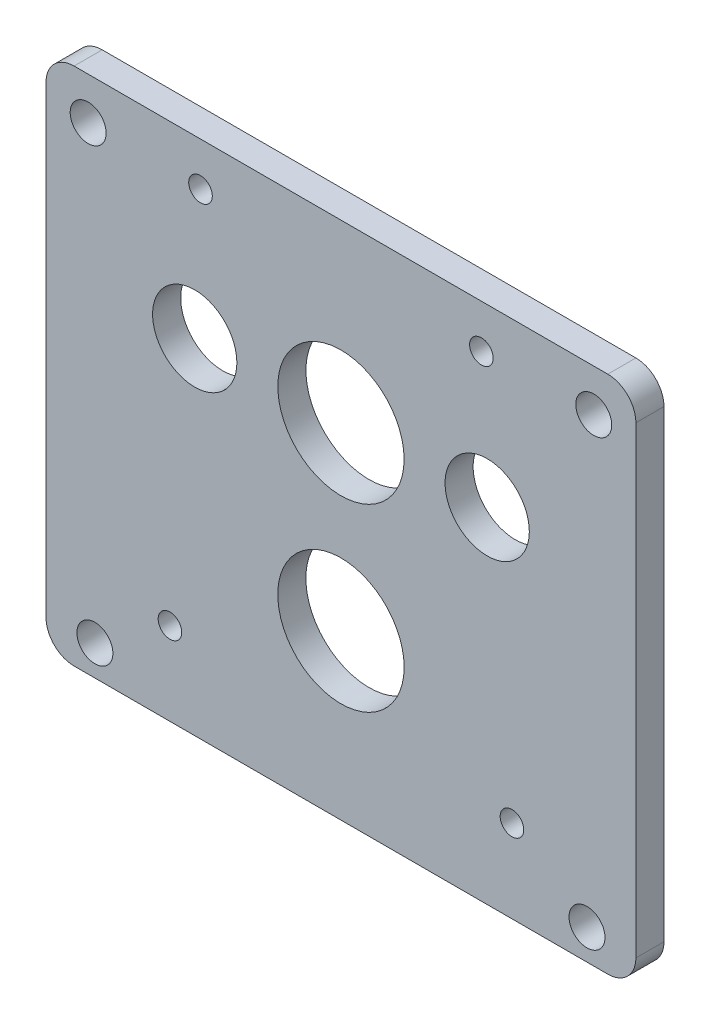
from build123d import *

# Parameters (mm, degrees)
SKETCH1_W           = 133.35
SKETCH1_H           = 117.475
SKETCH1_R           = 14.2748
SKETCH1_R_2         = 9.525
SKETCH1_R_3         = 14.2875
SKETCH1_R_4         = 4.064
SKETCH1_R_5         = 2.667
BOSS_EXTRUDE1_DEPTH = 3.175
FILLET1_R           = 6.35


with BuildPart() as part:
    # Sketch1 → Boss-Extrude1 (new, symmetric)
    with BuildSketch(Plane.XY):
        with Locations((0, 21.6789)):
            Rectangle(SKETCH1_W, SKETCH1_H)
        with Locations((0, 40.7162)):
            Circle(SKETCH1_R, mode=Mode.SUBTRACT)
        with Locations((33.0581, 40.7162)):
            Circle(SKETCH1_R_2, mode=Mode.SUBTRACT)
        with Locations((-33.0581, 40.7162)):
            Circle(SKETCH1_R_2, mode=Mode.SUBTRACT)
        Circle(SKETCH1_R_3, mode=Mode.SUBTRACT)
        with Locations((-57.15, 70.8914)):
            Circle(SKETCH1_R_4, mode=Mode.SUBTRACT)
        with Locations((-55.626, -30.2006)):
            Circle(SKETCH1_R_4, mode=Mode.SUBTRACT)
        with Locations((57.15, 70.8914)):
            Circle(SKETCH1_R_4, mode=Mode.SUBTRACT)
        with Locations((55.626, -30.2006)):
            Circle(SKETCH1_R_4, mode=Mode.SUBTRACT)
        with Locations((38.6588, -18.3134)):
            Circle(SKETCH1_R_5, mode=Mode.SUBTRACT)
        with Locations((-38.6588, -18.3134)):
            Circle(SKETCH1_R_5, mode=Mode.SUBTRACT)
        with Locations((-31.75, 70.5866)):
            Circle(SKETCH1_R_5, mode=Mode.SUBTRACT)
        with Locations((31.75, 70.5866)):
            Circle(SKETCH1_R_5, mode=Mode.SUBTRACT)
    extrude(amount=BOSS_EXTRUDE1_DEPTH, both=True)

    # Fillet1
    fillet1_edges = [part.edges().sort_by_distance(p)[0] for p in [
        (66.675, -37.0586, 0),
        (-66.675, -37.0586, 0),
        (-66.675, 80.4164, 0),
        (66.675, 80.4164, 0),
    ]]
    fillet(fillet1_edges, radius=FILLET1_R)


solid = part.part
